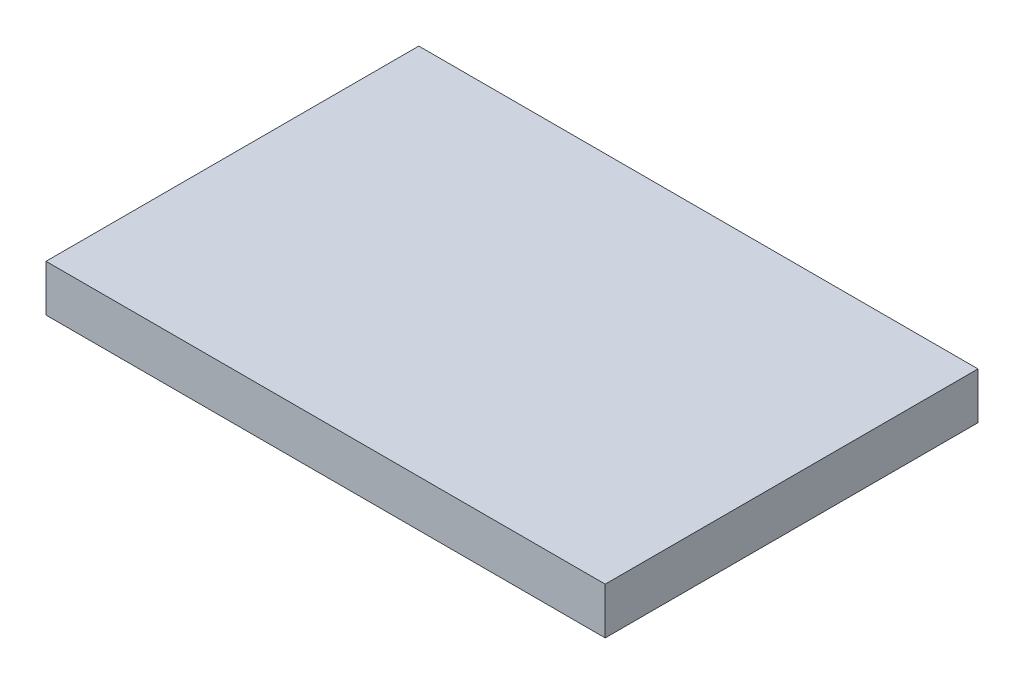
from build123d import *

# Parameters (mm, degrees)
SKETCH1_W           = 12
SKETCH1_H           = 8
BOSS_EXTRUDE1_DEPTH = 1


with BuildPart() as part:
    # Sketch1 → Boss-Extrude1 (new body)
    with BuildSketch(Plane(origin=(0, 0, 0), x_dir=(1, 0, 0), z_dir=(0, 1, 0))):
        with Locations((6, 4)):
            Rectangle(SKETCH1_W, SKETCH1_H)
    extrude(amount=BOSS_EXTRUDE1_DEPTH)


solid = part.part
